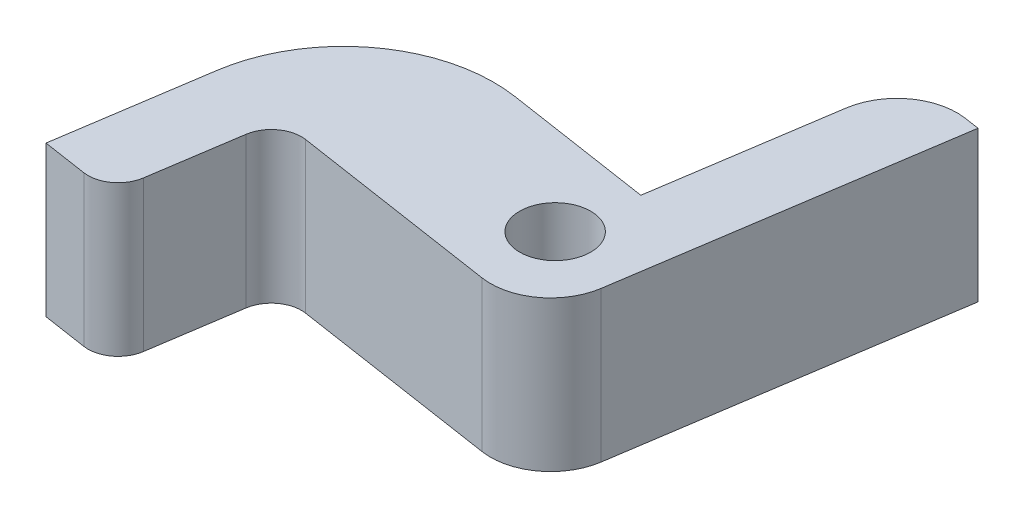
from build123d import *

# Parameters (mm, degrees)
SKETCH2_R           = 1.5
BOSS_EXTRUDE1_DEPTH = 6.35
FILLET1_R           = 1.27
FILLET2_R           = 2.54
FILLET3_R           = 6.35
FILLET4_R           = 2.54


with BuildPart() as part:
    # Sketch2 → Boss-Extrude1 (new body)
    with BuildSketch(Plane(origin=(0, 0, 0), x_dir=(1, 0, 0), z_dir=(0, 1, 0))):
        Polygon((-2.553535433, -69.492861925), (-4.46233448, -82.048597116), (-1.323400683, -82.525796878), (-0.369001159, -76.247929282), (12.186734033, -78.15672833), (12.663933794, -75.017794532), (14.668172794, -61.834272581), (11.529238997, -61.357072819), (10.002199758, -71.401660972), align=None)
        with Locations(Location((9.524999997, -74.54059477, 0), (0, 0, 270))):
            Circle(SKETCH2_R, mode=Mode.SUBTRACT)
    extrude(amount=BOSS_EXTRUDE1_DEPTH)

    # Fillet1
    fillet1_edges = [part.edges().sort_by_distance(p)[0] for p in [
        (-0.369001159, 3.175, 76.247929282),
        (-1.323400683, 3.175, 82.525796878),
    ]]
    fillet(fillet1_edges, radius=FILLET1_R)

    # Fillet2
    fillet2_edges = [part.edges().sort_by_distance(p)[0] for p in [
        (11.529238997, 3.175, 61.357072819),
    ]]
    fillet(fillet2_edges, radius=FILLET2_R)

    # Fillet3
    fillet3_edges = [part.edges().sort_by_distance(p)[0] for p in [
        (-2.553535433, 3.175, 69.492861925),
    ]]
    fillet(fillet3_edges, radius=FILLET3_R)

    # Fillet4
    fillet4_edges = [part.edges().sort_by_distance(p)[0] for p in [
        (12.186734033, 3.175, 78.15672833),
    ]]
    fillet(fillet4_edges, radius=FILLET4_R)


solid = part.part
